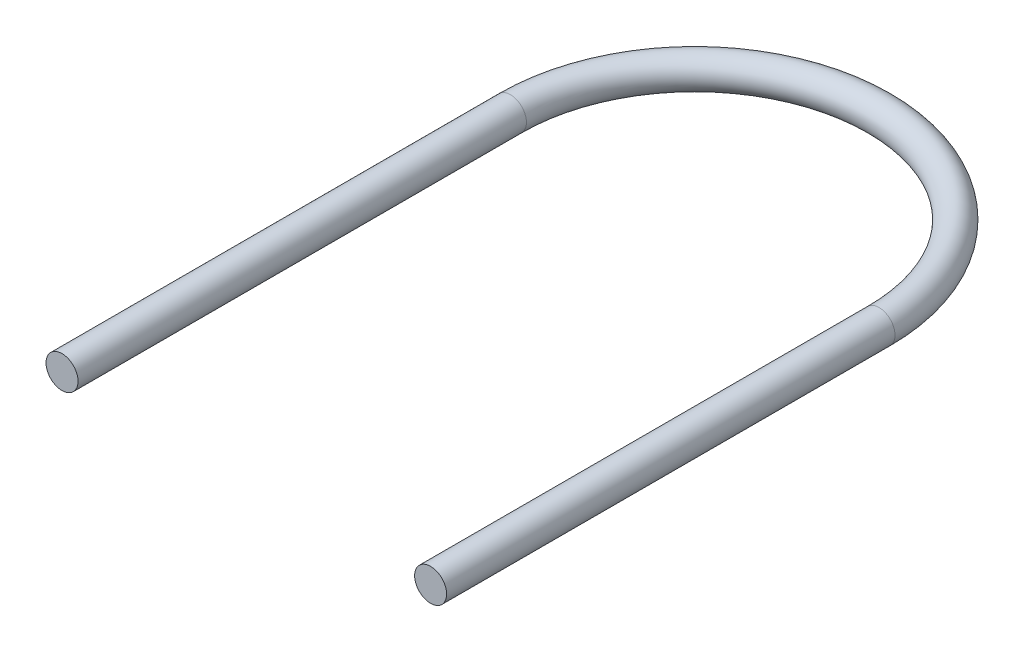
from build123d import *

# Parameters (mm, degrees)
SKETCH6_R = 3.0226


with BuildPart() as part:
    # Sweep2: sweep along a path in Sketch1
    with BuildLine(Plane(origin=(0, 0, 0), x_dir=(1, 0, 0), z_dir=(0, 1, 0))) as sweep2_path:
        Line((-34.7726, -84.6074), (-34.7726, 0))
        ThreePointArc((-34.7726, 0), (0, 34.7726), (34.7726, 0))
        Line((34.7726, 0), (34.7726, -84.6074))
    # Sketch6 → Sweep2 (sweep)
    with BuildSketch(Plane.XY.offset(84.6074)):
        with Locations((34.7726, 0)):
            Circle(SKETCH6_R)
    sweep(path=sweep2_path.line)


solid = part.part
